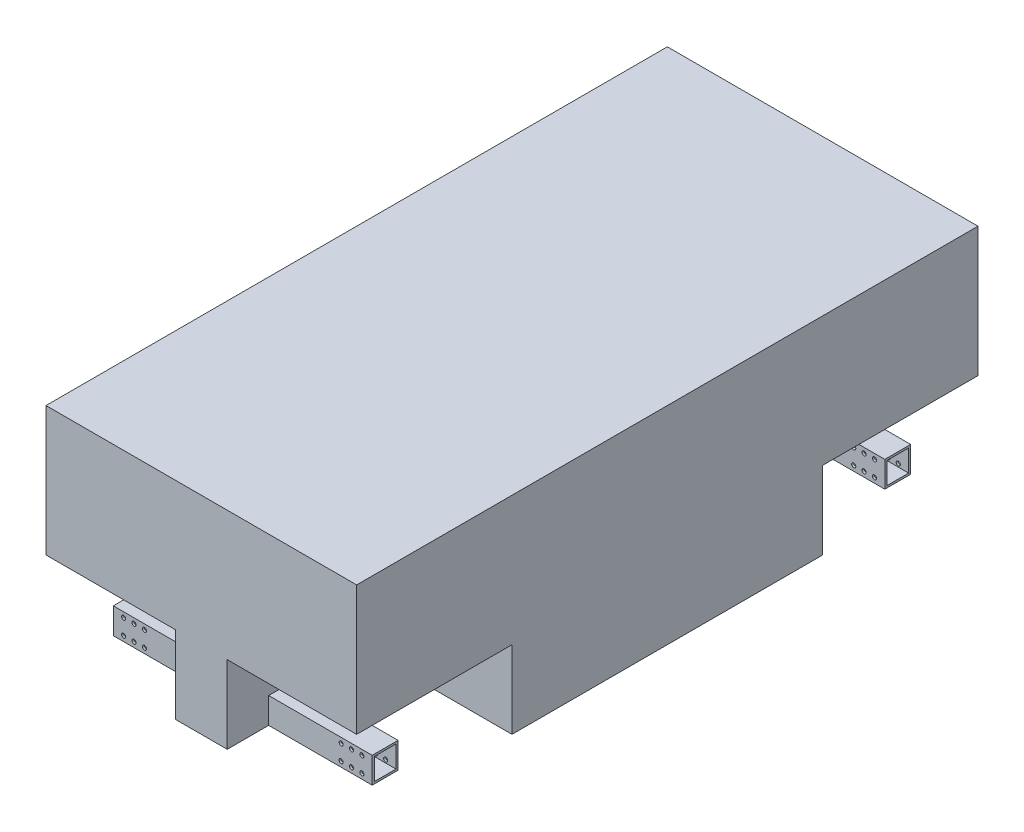
from build123d import *

# Parameters (mm, degrees)
BOSS_EXTRUDE1_DEPTH       = 150
BOSS_EXTRUDE1_DEPTH_BACK  = 150
SKETCH2_W                 = 600
SKETCH2_H                 = 200
SKETCH3_W                 = 150
SKETCH3_H                 = 75
CUT_EXTRUDE1_DEPTH        = 125
SKETCH4_W                 = 25
SKETCH4_H                 = 25
SKETCH4_W_2               = 21
SKETCH4_H_2               = 21
BOSS_EXTRUDE2_DEPTH       = 100
SKETCH5_R                 = 2
CUT_EXTRUDE2_DEPTH        = 25
MIRROR3_COPY_1_SKETCH_W   = 25
MIRROR3_COPY_1_SKETCH_H   = 25
MIRROR3_COPY_1_SKETCH_W_2 = 21
MIRROR3_COPY_1_SKETCH_H_2 = 21
MIRROR3_COPY_1_DEPTH      = 100
MIRROR3_COPY_2_SKETCH_R   = 2
MIRROR3_COPY_2_DEPTH      = 25
MIRROR3_COPY_3_SKETCH_W   = 25
MIRROR3_COPY_3_SKETCH_H   = 25
MIRROR3_COPY_3_SKETCH_W_2 = 21
MIRROR3_COPY_3_SKETCH_H_2 = 21
MIRROR3_COPY_3_DEPTH      = 100
MIRROR3_COPY_4_SKETCH_R   = 2
MIRROR3_COPY_4_DEPTH      = 25


with BuildPart() as part:
    # Sketch2 → Boss-Extrude1 (new, two sides: drawn at the far end of the back side and taken through both)
    with BuildSketch(Plane(origin=(0, 0, 0), x_dir=(0, 0, -1), z_dir=(1, 0, 0)).offset(-BOSS_EXTRUDE1_DEPTH_BACK)):
        Rectangle(SKETCH2_W, SKETCH2_H)
    extrude(amount=BOSS_EXTRUDE1_DEPTH + BOSS_EXTRUDE1_DEPTH_BACK)

    # Sketch3 → Cut-Extrude1 (cut)
    with BuildSketch(Plane(origin=(150, 0, 0), x_dir=(0, 0, -1), z_dir=(1, 0, 0))):
        with Locations((-225, -62.5)):
            Rectangle(SKETCH3_W, SKETCH3_H)
        with Locations((225, -62.5)):
            Rectangle(SKETCH3_W, SKETCH3_H)
    cut_extrude1 = extrude(amount=-CUT_EXTRUDE1_DEPTH, mode=Mode.SUBTRACT)

    # Mirror1: Cut-Extrude1 across plane
    add(cut_extrude1.mirror(Plane(origin=(0, 0, 0), x_dir=(0, 0, 1), z_dir=(1, 0, 0))), mode=Mode.SUBTRACT)

    # Sketch4 → Boss-Extrude2 (add)
    with BuildSketch(Plane(origin=(25, 0, 0), x_dir=(0, 0, -1), z_dir=(1, 0, 0))):
        with Locations((-247.5, -87.5)):
            Rectangle(SKETCH4_W, SKETCH4_H)
        with Locations((-247.5, -87.5)):
            Rectangle(SKETCH4_W_2, SKETCH4_H_2, mode=Mode.SUBTRACT)
    boss_extrude2 = extrude(amount=BOSS_EXTRUDE2_DEPTH)

    # Sketch5 → Cut-Extrude2 (cut)
    with BuildSketch(Plane.XY.offset(260)):
        with Locations((115, -80)):
            Circle(SKETCH5_R)
        with Locations((105, -80)):
            Circle(SKETCH5_R)
        with Locations((95, -80)):
            Circle(SKETCH5_R)
        with Locations((115, -95)):
            Circle(SKETCH5_R)
        with Locations((105, -95)):
            Circle(SKETCH5_R)
        with Locations((95, -95)):
            Circle(SKETCH5_R)
    cut_extrude2 = extrude(amount=-CUT_EXTRUDE2_DEPTH, mode=Mode.SUBTRACT)

    # Mirror2: Boss-Extrude2, Cut-Extrude2 across plane
    add(boss_extrude2.mirror(Plane(origin=(0, 0, 0), x_dir=(0, 0, 1), z_dir=(1, 0, 0))))
    add(cut_extrude2.mirror(Plane(origin=(0, 0, 0), x_dir=(0, 0, 1), z_dir=(1, 0, 0))), mode=Mode.SUBTRACT)

    # Mirror3 copy 1 sketch → Mirror3 copy 1 (add)
    with BuildSketch(Plane.ZY.offset(25)):
        with Locations((-247.5, -87.5)):
            Rectangle(MIRROR3_COPY_1_SKETCH_W, MIRROR3_COPY_1_SKETCH_H)
        with Locations((-247.5, -87.5)):
            Rectangle(MIRROR3_COPY_1_SKETCH_W_2, MIRROR3_COPY_1_SKETCH_H_2, mode=Mode.SUBTRACT)
    extrude(amount=MIRROR3_COPY_1_DEPTH)

    # Mirror3 copy 2 sketch → Mirror3 copy 2 (cut)
    with BuildSketch(Plane(origin=(0, 0, -260), x_dir=(-1, 0, 0), z_dir=(0, 0, -1))):
        with Locations((115, -80)):
            Circle(MIRROR3_COPY_2_SKETCH_R)
        with Locations((105, -80)):
            Circle(MIRROR3_COPY_2_SKETCH_R)
        with Locations((95, -80)):
            Circle(MIRROR3_COPY_2_SKETCH_R)
        with Locations((115, -95)):
            Circle(MIRROR3_COPY_2_SKETCH_R)
        with Locations((105, -95)):
            Circle(MIRROR3_COPY_2_SKETCH_R)
        with Locations((95, -95)):
            Circle(MIRROR3_COPY_2_SKETCH_R)
    extrude(amount=-MIRROR3_COPY_2_DEPTH, mode=Mode.SUBTRACT)

    # Mirror3 copy 3 sketch → Mirror3 copy 3 (add)
    with BuildSketch(Plane(origin=(25, 0, 0), x_dir=(0, 0, 1), z_dir=(1, 0, 0))):
        with Locations((-247.5, 87.5)):
            Rectangle(MIRROR3_COPY_3_SKETCH_W, MIRROR3_COPY_3_SKETCH_H)
        with Locations((-247.5, 87.5)):
            Rectangle(MIRROR3_COPY_3_SKETCH_W_2, MIRROR3_COPY_3_SKETCH_H_2, mode=Mode.SUBTRACT)
    extrude(amount=MIRROR3_COPY_3_DEPTH)

    # Mirror3 copy 4 sketch → Mirror3 copy 4 (cut)
    with BuildSketch(Plane(origin=(0, 0, -260), x_dir=(1, 0, 0), z_dir=(0, 0, -1))):
        with Locations((115, 80)):
            Circle(MIRROR3_COPY_4_SKETCH_R)
        with Locations((105, 80)):
            Circle(MIRROR3_COPY_4_SKETCH_R)
        with Locations((95, 80)):
            Circle(MIRROR3_COPY_4_SKETCH_R)
        with Locations((115, 95)):
            Circle(MIRROR3_COPY_4_SKETCH_R)
        with Locations((105, 95)):
            Circle(MIRROR3_COPY_4_SKETCH_R)
        with Locations((95, 95)):
            Circle(MIRROR3_COPY_4_SKETCH_R)
    extrude(amount=-MIRROR3_COPY_4_DEPTH, mode=Mode.SUBTRACT)


solid = part.part
